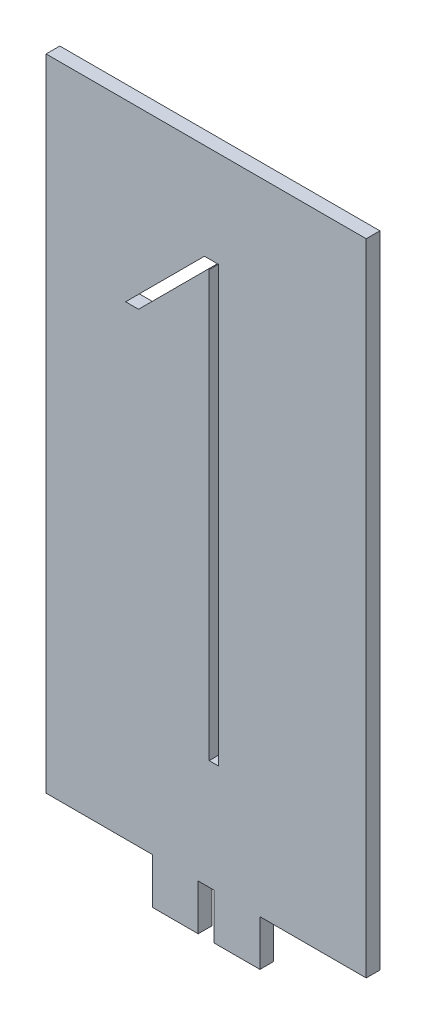
from build123d import *

# Parameters (mm, degrees)
SKIZZE1_W                       = 35
SKIZZE1_H                       = 75
AUFSATZ_LINEAR_AUSTRAGEN1_DEPTH = 1.5
SKIZZE2_W                       = 11.63
SKIZZE2_H                       = 5
SKIZZE2_W_2                     = 11.62
SKIZZE2_W_3                     = 1.75
SCHNITT_LINEAR_AUSTRAGEN1_DEPTH = 1.5
SCHNITT_LINEAR_AUSTRAGEN3_DEPTH = 1.5


with BuildPart() as part:
    # Skizze1 → Aufsatz-Linear austragen1 (new body)
    with BuildSketch(Plane.XY):
        with Locations((17.5, 37.5)):
            Rectangle(SKIZZE1_W, SKIZZE1_H)
    extrude(amount=AUFSATZ_LINEAR_AUSTRAGEN1_DEPTH)

    # Skizze2 → Schnitt-Linear austragen1 (cut)
    with BuildSketch(Plane.XY.offset(1.5)):
        with Locations((5.815, 2.5)):
            Rectangle(SKIZZE2_W, SKIZZE2_H)
        with Locations((29.19, 2.5)):
            Rectangle(SKIZZE2_W_2, SKIZZE2_H)
        with Locations((17.505, 2.5)):
            Rectangle(SKIZZE2_W_3, SKIZZE2_H)
    extrude(amount=-SCHNITT_LINEAR_AUSTRAGEN1_DEPTH, mode=Mode.SUBTRACT)

    # Skizze6 → Schnitt-Linear austragen3 (cut)
    with BuildSketch(Plane.XY.offset(1.5)):
        Polygon((8.694210646, 55.87711337), (17.317097276, 64.5), (18.831310838, 64.5), (18.831310838, 17), (17.831310838, 17), (17.831310838, 63.5), (17.731310838, 63.5), (10.108424208, 55.87711337), align=None)
    extrude(amount=-SCHNITT_LINEAR_AUSTRAGEN3_DEPTH, mode=Mode.SUBTRACT)


solid = part.part
